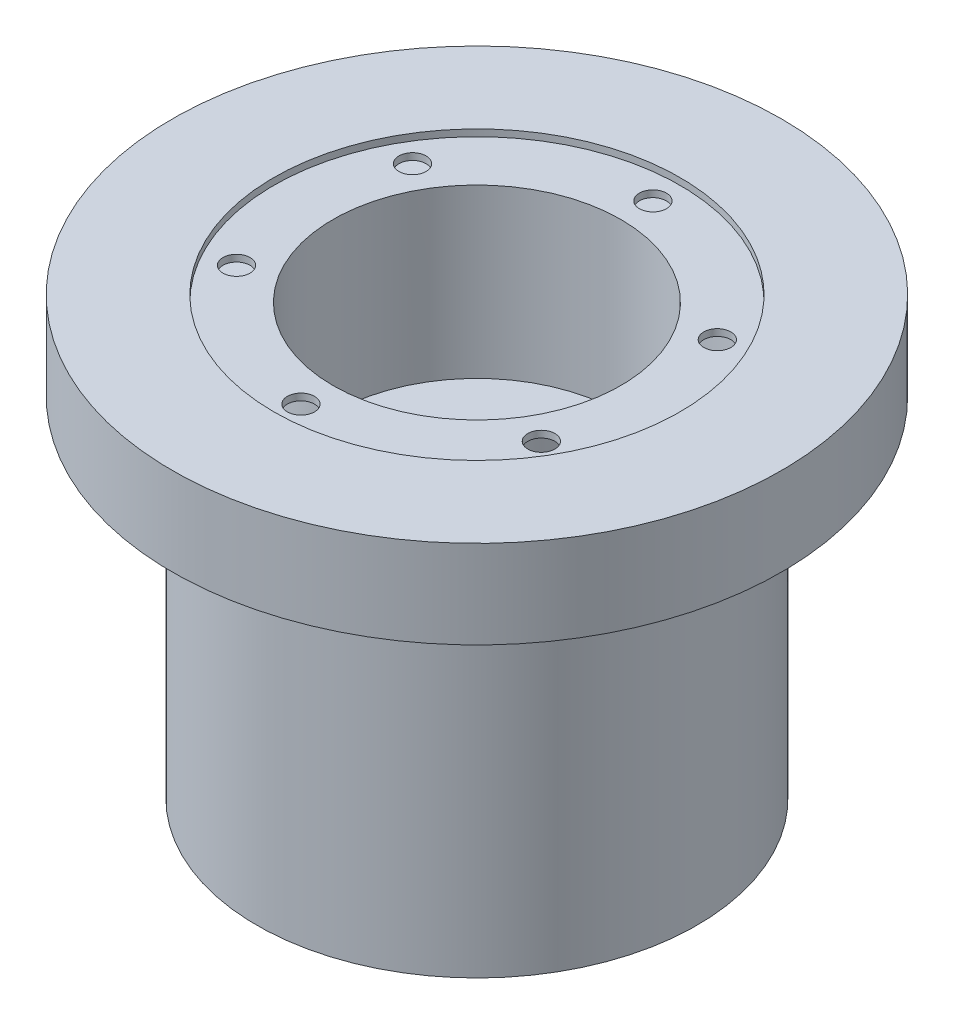
from build123d import *

# Parameters (mm, degrees)
SKETCH4_R          = 30
CUT_EXTRUDE3_DEPTH = 1
SKETCH5_R          = 2
CUT_EXTRUDE4_DEPTH = 6


with BuildPart() as part:
    # Sketch2 → Revolve-Thin1 (revolve)
    with BuildSketch(Plane.XY, mode=Mode.PRIVATE) as revolve_thin1_sk:
        Polygon((-30.230643129, 25.839523207), (-6.494921795, 25.839523207), (-6.494921795, 21.839523207), (-6.494921795, 0.092953851), (1.505078205, 0.092953851), (1.505078205, -3.652740104), (-2.730643129, -20.632394541), (-2.730643129, -23.886700586), (-5.730643129, -23.886700586), (-5.730643129, -30.625568886), (-5.730643129, -38.610085728), (-17.730643129, -38.610085728), (-17.730643129, 12.839523207), (-30.230643129, 12.839523207), align=None)
        Polygon((-28.230643129, 23.839523207), (-8.494921795, 23.839523207), (-8.494921795, 21.839523207), (-8.494921795, -1.907046149), (-0.494921795, -1.907046149), (-0.494921795, -3.407046149), (-4.730643129, -20.386700586), (-4.730643129, -21.886700586), (-7.730643129, -21.886700586), (-7.730643129, -30.625568886), (-7.730643129, -36.610085728), (-15.730643129, -36.610085728), (-15.730643129, 14.839523207), (-28.230643129, 14.839523207), align=None, mode=Mode.SUBTRACT)
    revolve(revolve_thin1_sk.sketch.rotate(Axis((14.769356871, -26.256134736, 0), (0, 1, 0)), 270), axis=Axis((14.769356871, -26.256134736, 0), (0, 1, 0)))

    # Sketch4 → Cut-Extrude3 (cut)
    with BuildSketch(Plane(origin=(0, 25.839523207, 0), x_dir=(1, 0, 0), z_dir=(0, 1, 0))):
        with Locations(Location((14.769356871, 0, 0), (0, 0, 270))):
            Circle(SKETCH4_R)
    extrude(amount=-CUT_EXTRUDE3_DEPTH, mode=Mode.SUBTRACT)

    # Sketch5 → Cut-Extrude4 (cut)
    with BuildSketch(Plane(origin=(0, 25.839523207, 0), x_dir=(1, 0, 0), z_dir=(0, 1, 0))):
        with Locations(Location((14.769356871, 26, 0), (0, 0, 270))):
            Circle(SKETCH5_R)
        with Locations(Location((37.28601737, 13, 0), (0, 0, 270))):
            Circle(SKETCH5_R)
        with Locations(Location((37.28601737, -13, 0), (0, 0, 270))):
            Circle(SKETCH5_R)
        with Locations(Location((14.769356871, -26, 0), (0, 0, 270))):
            Circle(SKETCH5_R)
        with Locations(Location((-7.747303627, -13, 0), (0, 0, 270))):
            Circle(SKETCH5_R)
        with Locations(Location((-7.747303627, 13, 0), (0, 0, 270))):
            Circle(SKETCH5_R)
    extrude(amount=-CUT_EXTRUDE4_DEPTH, mode=Mode.SUBTRACT)


solid = part.part
